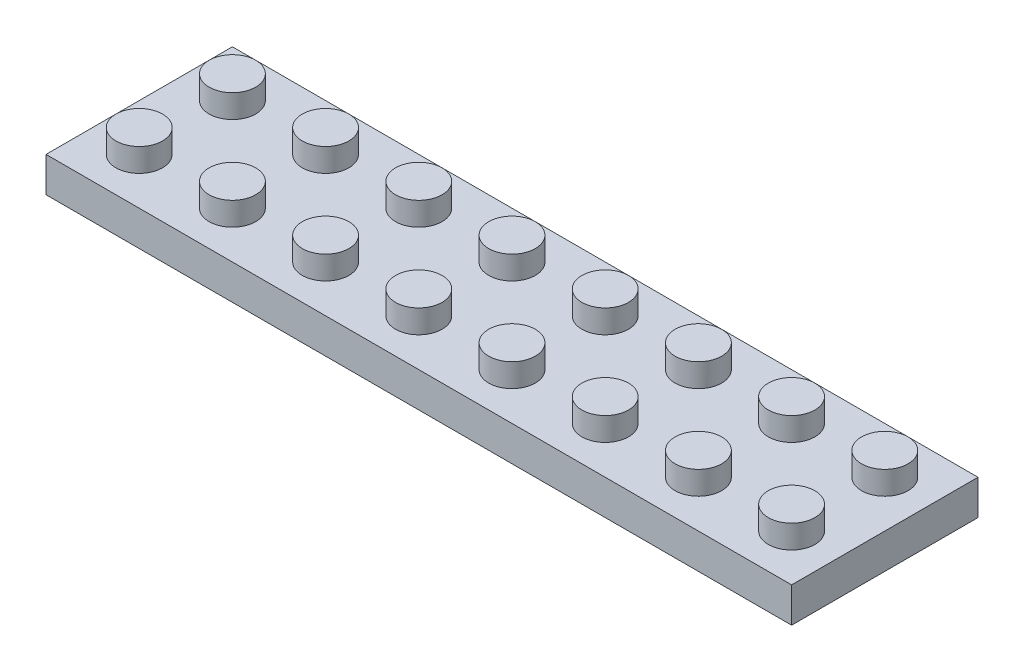
from build123d import *

# Parameters (mm, degrees)
SKETCH1_W           = 64
SKETCH1_H           = 16
BOSS_EXTRUDE1_DEPTH = 3
SKETCH2_R           = 2
BOSS_EXTRUDE2_DEPTH = 2
SHELL1_T            = -1
SKETCH3_R           = 2.8
SKETCH3_R_2         = 1.8
BOSS_EXTRUDE3_DEPTH = 2
LPATTERN1_COUNT     = 7
LPATTERN1_PITCH     = 8


with BuildPart() as part:
    # Sketch1 → Boss-Extrude1 (new body)
    with BuildSketch(Plane(origin=(0, 0, 0), x_dir=(1, 0, 0), z_dir=(0, 1, 0))):
        Rectangle(SKETCH1_W, SKETCH1_H)
    extrude(amount=BOSS_EXTRUDE1_DEPTH)

    # Sketch2 → Boss-Extrude2 (add)
    with BuildSketch(Plane(origin=(0, 3, 0), x_dir=(1, 0, 0), z_dir=(0, 1, 0))):
        with Locations(Location((-28, 4, 0), (0, 0, 90))):
            Circle(SKETCH2_R)
        with Locations(Location((-20, 4, 0), (0, 0, 90))):
            Circle(SKETCH2_R)
        with Locations(Location((-12, 4, 0), (0, 0, 90))):
            Circle(SKETCH2_R)
        with Locations(Location((-4, 4, 0), (0, 0, 90))):
            Circle(SKETCH2_R)
        with Locations(Location((4, 4, 0), (0, 0, 90))):
            Circle(SKETCH2_R)
        with Locations(Location((12, 4, 0), (0, 0, 90))):
            Circle(SKETCH2_R)
        with Locations(Location((20, 4, 0), (0, 0, 90))):
            Circle(SKETCH2_R)
        with Locations(Location((28, 4, 0), (0, 0, 90))):
            Circle(SKETCH2_R)
        with Locations(Location((-20, -4, 0), (0, 0, 90))):
            Circle(SKETCH2_R)
        with Locations(Location((-12, -4, 0), (0, 0, 90))):
            Circle(SKETCH2_R)
        with Locations(Location((-4, -4, 0), (0, 0, 90))):
            Circle(SKETCH2_R)
        with Locations(Location((4, -4, 0), (0, 0, 90))):
            Circle(SKETCH2_R)
        with Locations(Location((12, -4, 0), (0, 0, 90))):
            Circle(SKETCH2_R)
        with Locations(Location((20, -4, 0), (0, 0, 90))):
            Circle(SKETCH2_R)
        with Locations(Location((28, -4, 0), (0, 0, 90))):
            Circle(SKETCH2_R)
        with Locations(Location((-28, -4, 0), (0, 0, 90))):
            Circle(SKETCH2_R)
    extrude(amount=BOSS_EXTRUDE2_DEPTH)

    # Shell1
    shell1_openings = [part.faces().sort_by_distance(p)[0] for p in [
        (0, 0, 0),
    ]]
    offset(amount=SHELL1_T, openings=shell1_openings, kind=Kind.INTERSECTION)

    # Sketch3 → Boss-Extrude3 (add)
    with BuildSketch(Plane.XZ.offset(-2)):
        with Locations(Location((-24, 0, 0), (0, 0, 270))):
            Circle(SKETCH3_R)
        with Locations(Location((-24, 0, 0), (0, 0, 270))):
            Circle(SKETCH3_R_2, mode=Mode.SUBTRACT)
    boss_extrude3 = extrude(amount=BOSS_EXTRUDE3_DEPTH)

    # LPattern1: Boss-Extrude3 ×7
    with Locations(*[(i * LPATTERN1_PITCH, 0, 0) for i in range(1, LPATTERN1_COUNT)]):
        add(boss_extrude3)


solid = part.part
